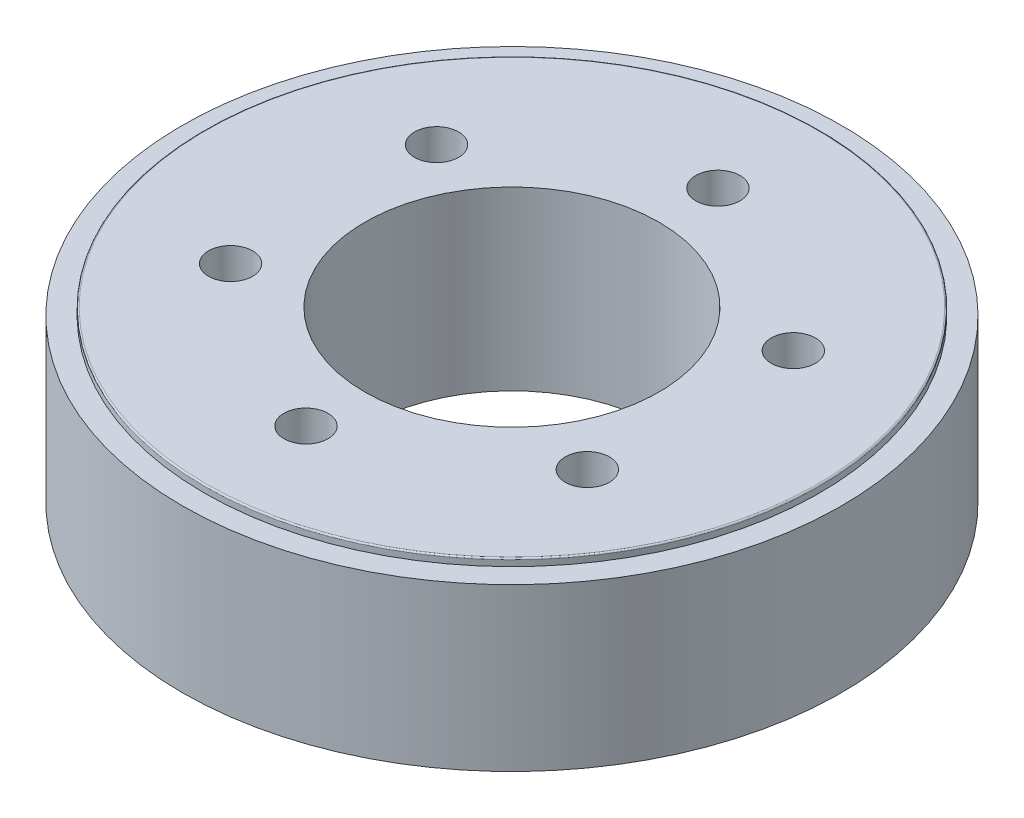
from build123d import *

# Parameters (mm, degrees)
SKETCH1_R           = 22.4
SKETCH1_R_2         = 10
BOSS_EXTRUDE1_DEPTH = 12
CUT_EXTRUDE1_START  = -0.5
SKETCH2_R           = 22.4
SKETCH2_R_2         = 20.9
CUT_EXTRUDE1_DEPTH  = 0.5
FILLET1_R           = 0.1
FILLET2_R           = 0.1
SKETCH3_R           = 1.5
CUT_EXTRUDE2_DEPTH  = 12


with BuildPart() as part:
    # Sketch1 → Boss-Extrude1 (new body)
    with BuildSketch(Plane(origin=(0, 0, 0), x_dir=(1, 0, 0), z_dir=(0, 1, 0))):
        with Locations(Location((0, 0, 0), (0, 0, 270))):
            Circle(SKETCH1_R)
        with Locations(Location((0, 0, 0), (0, 0, 270))):
            Circle(SKETCH1_R_2, mode=Mode.SUBTRACT)
    extrude(amount=BOSS_EXTRUDE1_DEPTH)

    # Sketch2 → Cut-Extrude1 (cut)
    with BuildSketch(Plane(origin=(0, 12, 0), x_dir=(1, 0, 0), z_dir=(0, 1, 0)).offset(CUT_EXTRUDE1_START)):
        with Locations(Location((0, 0, 0), (0, 0, 270))):
            Circle(SKETCH2_R)
        with Locations(Location((0, 0, 0), (0, 0, 270))):
            Circle(SKETCH2_R_2, mode=Mode.SUBTRACT)
    cut_extrude1 = extrude(amount=CUT_EXTRUDE1_DEPTH, mode=Mode.SUBTRACT)

    # Fillet1
    fillet1_edges = [part.edges().sort_by_distance(p)[0] for p in [
        (0, 12, -20.9),
    ]]
    fillet(fillet1_edges, radius=FILLET1_R)

    # Mirror3: Cut-Extrude1 across plane
    add(cut_extrude1.mirror(Plane.ZX.offset(6)), mode=Mode.SUBTRACT)

    # Fillet2
    fillet2_edges = [part.edges().sort_by_distance(p)[0] for p in [
        (0, 0, -20.9),
    ]]
    fillet(fillet2_edges, radius=FILLET2_R)

    # Sketch3 → Cut-Extrude2 (cut)
    with BuildSketch(Plane(origin=(0, 12, 0), x_dir=(1, 0, 0), z_dir=(0, 1, 0))):
        with Locations(Location((0, 14, 0), (0, 0, 270))):
            Circle(SKETCH3_R)
        with Locations(Location((12.124355653, 7, 0), (0, 0, 270))):
            Circle(SKETCH3_R)
        with Locations(Location((12.124355653, -7, 0), (0, 0, 270))):
            Circle(SKETCH3_R)
        with Locations(Location((0, -14, 0), (0, 0, 270))):
            Circle(SKETCH3_R)
        with Locations(Location((-12.124355653, -7, 0), (0, 0, 270))):
            Circle(SKETCH3_R)
        with Locations(Location((-12.124355653, 7, 0), (0, 0, 270))):
            Circle(SKETCH3_R)
    extrude(amount=-CUT_EXTRUDE2_DEPTH, mode=Mode.SUBTRACT)


solid = part.part
